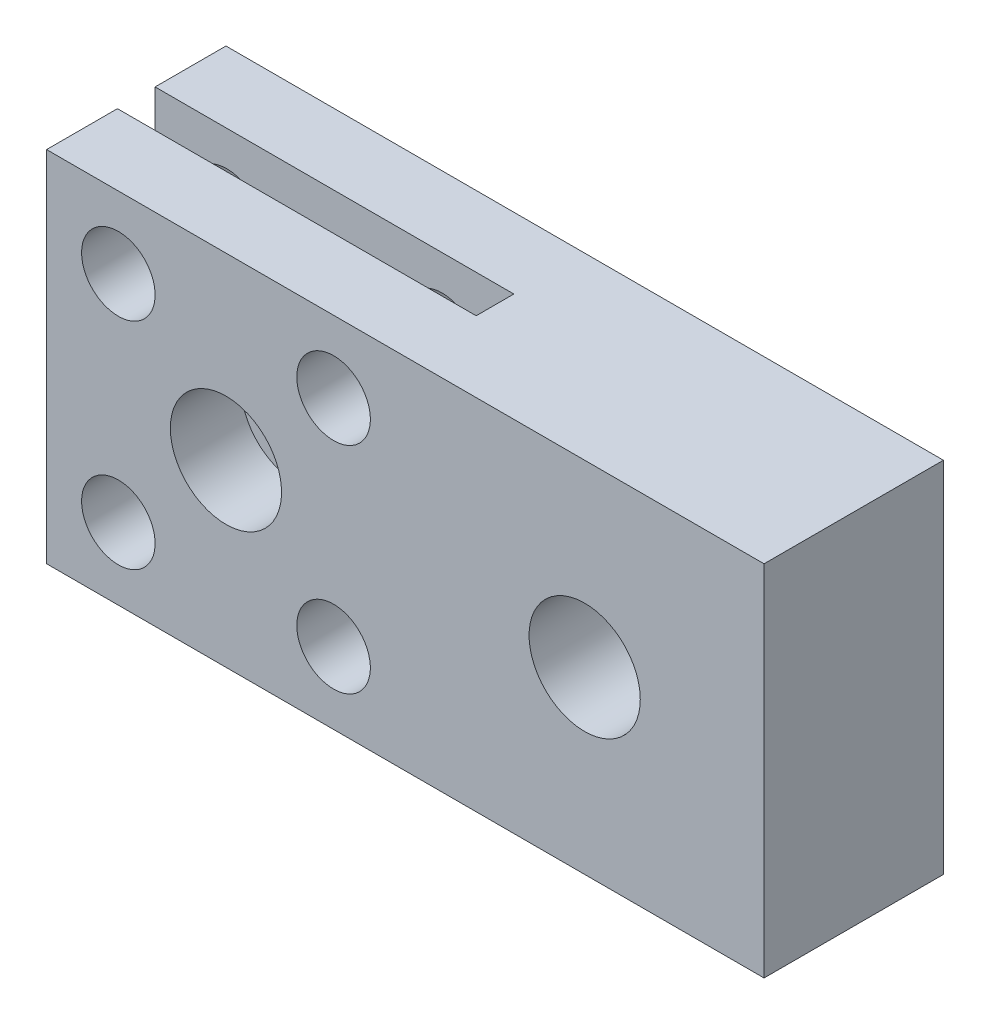
from build123d import *

# Parameters (mm, degrees)
ESQUISSE1_W             = 40
ESQUISSE1_H             = 20
BOSS_EXTRU_1_DEPTH      = 10
ESQUISSE3_W             = 40
ESQUISSE3_H             = 2.1
ENL_V_MAT_EXTRU_2_DEPTH = 31
ESQUISSE4_R             = 2.05
ENL_V_MAT_EXTRU_3_DEPTH = 25.494897428
ESQUISSE5_R             = 3.1
ENL_V_MAT_EXTRU_4_DEPTH = 10


with BuildPart() as part:
    # Esquisse1 → Boss.-Extru.1 (new body)
    with BuildSketch(Plane.XY):
        Rectangle(ESQUISSE1_W, ESQUISSE1_H)
    extrude(amount=BOSS_EXTRU_1_DEPTH)

    # Esquisse3 → Enlèv. mat.-Extru.2 (cut, through all)
    with BuildSketch(Plane(origin=(0, -10, 0), x_dir=(-1, 0, 0), z_dir=(0, -1, 0))):
        with Locations((20, -5)):
            Rectangle(ESQUISSE3_W, ESQUISSE3_H)
    extrude(amount=-ENL_V_MAT_EXTRU_2_DEPTH, mode=Mode.SUBTRACT)

    # Esquisse4 → Enlèv. mat.-Extru.3 (cut, through all)
    with BuildSketch(Plane(origin=(0, 0, 0), x_dir=(-1, 0, 0), z_dir=(0, 0, -1))):
        with Locations((16, 6)):
            Circle(ESQUISSE4_R)
        with Locations((4, 6)):
            Circle(ESQUISSE4_R)
        with Locations((4, -6)):
            Circle(ESQUISSE4_R)
        with Locations((16, -6)):
            Circle(ESQUISSE4_R)
    extrude(amount=-ENL_V_MAT_EXTRU_3_DEPTH, mode=Mode.SUBTRACT)

    # Esquisse5 → Enlèv. mat.-Extru.4 (cut)
    with BuildSketch(Plane(origin=(0, 0, 0), x_dir=(-1, 0, 0), z_dir=(0, 0, -1))):
        with Locations((10, 0)):
            Circle(ESQUISSE5_R)
        with Locations(Location((-10, 0, 0), (0, 0, 180))):
            Circle(ESQUISSE5_R)
    extrude(amount=-ENL_V_MAT_EXTRU_4_DEPTH, mode=Mode.SUBTRACT)


solid = part.part
